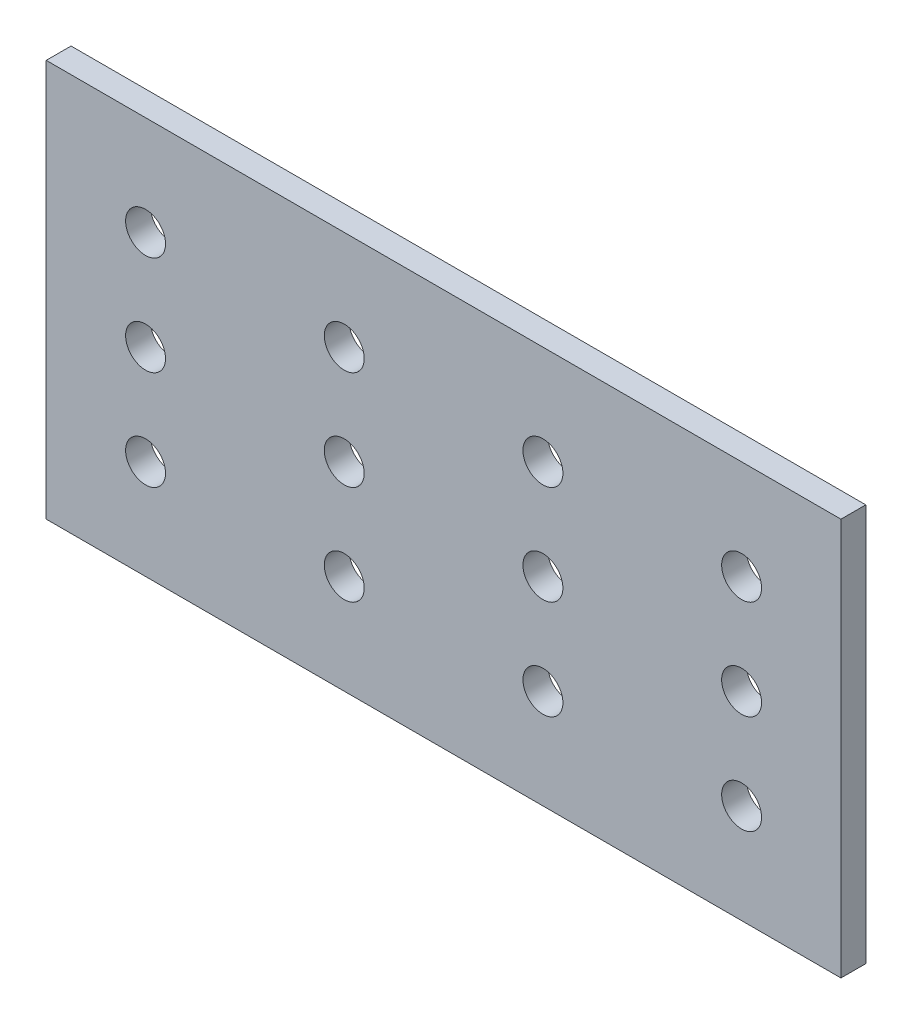
from build123d import *

# Parameters (mm, degrees)
SKETCH1_W           = 101.6
SKETCH1_H           = 50.8
BOSS_EXTRUDE1_DEPTH = 3.175
SKETCH2_R           = 2.5527
CUT_EXTRUDE1_DEPTH  = 57.884801353


with BuildPart() as part:
    # Sketch1 → Boss-Extrude1 (new body)
    with BuildSketch(Plane.XY):
        Rectangle(SKETCH1_W, SKETCH1_H)
    extrude(amount=BOSS_EXTRUDE1_DEPTH)

    # Sketch2 → Cut-Extrude1 (cut, through all)
    with BuildSketch(Plane.XY.offset(3.175)):
        with Locations((-38.1, 12.7)):
            Circle(SKETCH2_R)
        with Locations((-12.7, 12.7)):
            Circle(SKETCH2_R)
        with Locations((12.7, 12.7)):
            Circle(SKETCH2_R)
        with Locations((38.1, 12.7)):
            Circle(SKETCH2_R)
        with Locations((-12.7, 0)):
            Circle(SKETCH2_R)
        with Locations((12.7, 0)):
            Circle(SKETCH2_R)
        with Locations((38.1, 0)):
            Circle(SKETCH2_R)
        with Locations((-12.7, -12.7)):
            Circle(SKETCH2_R)
        with Locations((12.7, -12.7)):
            Circle(SKETCH2_R)
        with Locations((38.1, -12.7)):
            Circle(SKETCH2_R)
        with Locations((-38.1, 0)):
            Circle(SKETCH2_R)
        with Locations((-38.1, -12.7)):
            Circle(SKETCH2_R)
    extrude(amount=-CUT_EXTRUDE1_DEPTH, mode=Mode.SUBTRACT)


solid = part.part
